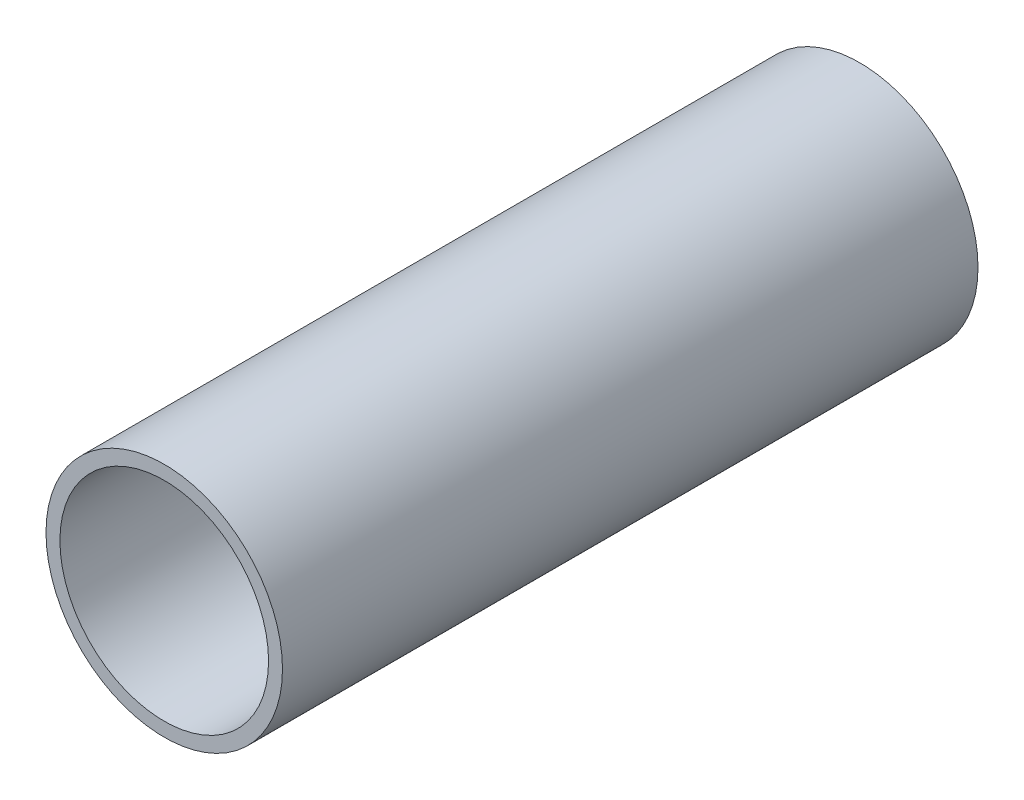
from build123d import *

# Parameters (mm, degrees)
SKETCH1_R           = 17
SKETCH1_R_2         = 15
BOSS_EXTRUDE1_DEPTH = 100


with BuildPart() as part:
    # Sketch1 → Boss-Extrude1 (new body)
    with BuildSketch(Plane.XY):
        Circle(SKETCH1_R)
        Circle(SKETCH1_R_2, mode=Mode.SUBTRACT)
    extrude(amount=BOSS_EXTRUDE1_DEPTH)


solid = part.part
